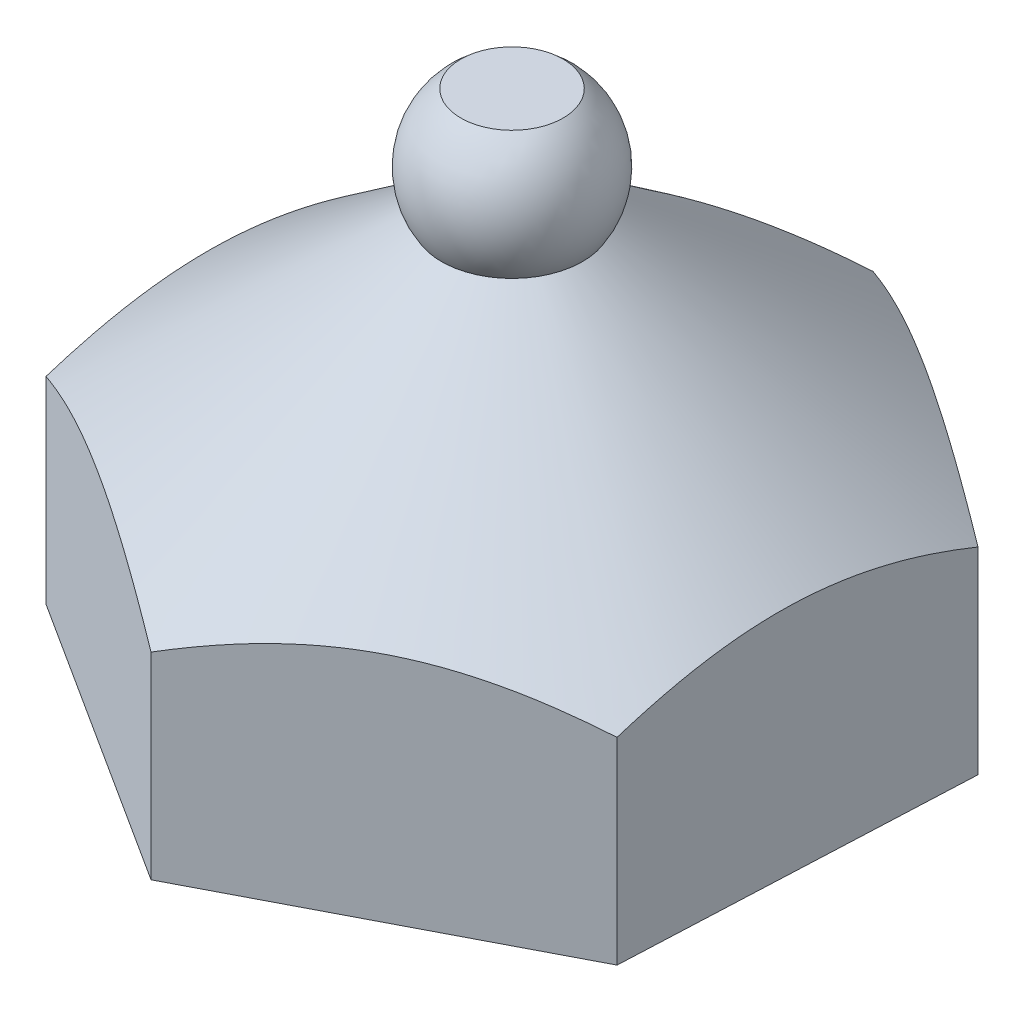
from build123d import *

# Parameters (mm, degrees)
SKETCH2_OUTSIDE_W  = 95.562
SKETCH2_OUTSIDE_H  = 95.562
CUT_EXTRUDE1_DEPTH = 80.973294862
CHAMFER1_SIZE      = 2


with BuildPart() as part:
    # Sketch1 → Revolve1 (revolve)
    with BuildSketch(Plane.XY):
        with BuildLine():
            Line((-7.160370484, 51.149500409), (-35.047619048, 30))
            Line((-35.047619048, 30), (-35.047619048, 10))
            Line((-35.047619048, 10), (-10, 10))
            Line((-10, 10), (-10, 0))
            Line((-10, 0), (0, 0))
            Line((0, 0), (0, 62.761904762))
            Line((0, 62.761904762), (-5.182953714, 62.761904762))
            ThreePointArc((-5.182953714, 62.761904762), (-8.473570486, 57.347682757), (-7.160370484, 51.149500409))
        make_face()
    revolve(axis=Axis((0, 62.761904762, 0), (0, -1, 0)))

    # Sketch2 outside → Cut-Extrude1 (cut, through all)
    with BuildSketch(Plane(origin=(0, 62.761904762, 0), x_dir=(1, 0, 0), z_dir=(0, 1, 0))):
        Rectangle(SKETCH2_OUTSIDE_W, SKETCH2_OUTSIDE_H)
        Polygon((-31.112953649, -16.134426428), (-1.583653662, -35.011821461), (29.529299986, -18.877395033), (31.112953649, 16.134426428), (1.583653662, 35.011821461), (-29.529299986, 18.877395033), align=None, mode=Mode.SUBTRACT)
    extrude(amount=-CUT_EXTRUDE1_DEPTH, mode=Mode.SUBTRACT)

    # Chamfer1
    chamfer1_edges = [part.edges().sort_by_distance(p)[0] for p in [
        (10, 0, 0),
    ]]
    chamfer(chamfer1_edges, length=CHAMFER1_SIZE)


solid = part.part
